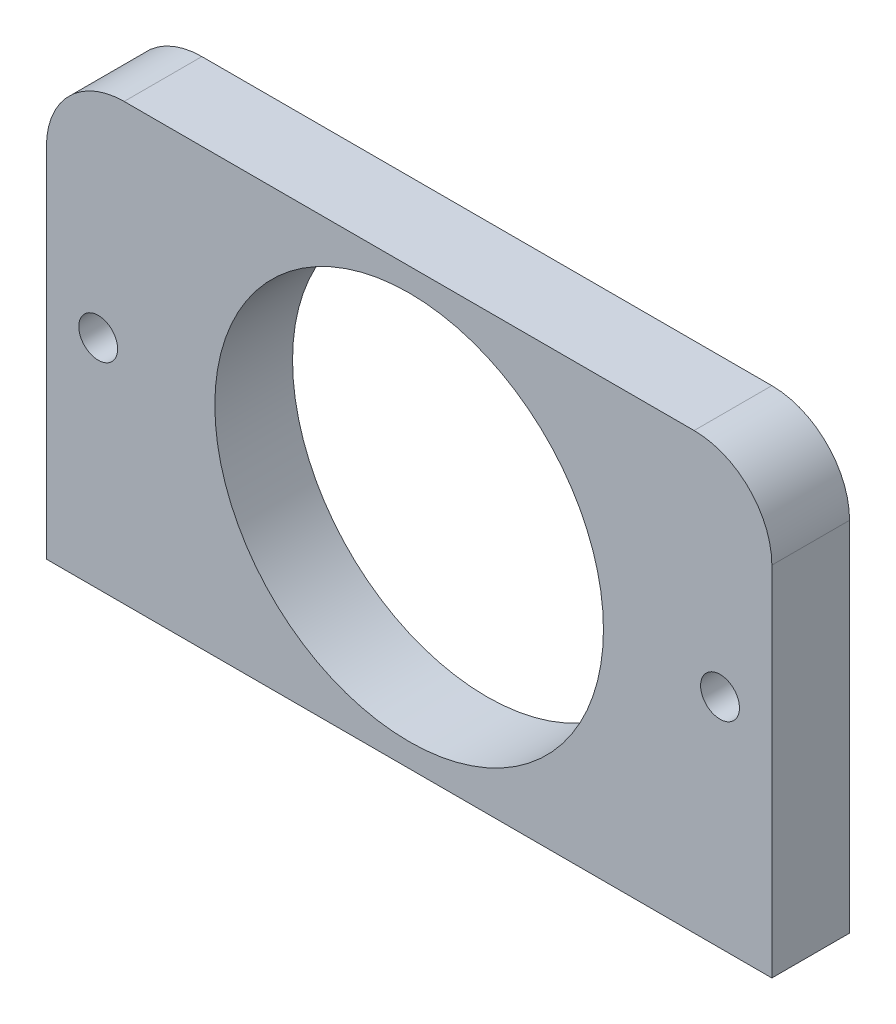
from build123d import *

# Parameters (mm, degrees)
SKETCH1_R           = 37.5
SKETCH1_R_2         = 3.75
BOSS_EXTRUDE1_DEPTH = 15


with BuildPart() as part:
    # Sketch1 → Boss-Extrude1 (new body)
    with BuildSketch(Plane.XY):
        with BuildLine():
            Line((-70, -42), (70, -42))
            Line((70, -42), (70, 27))
            ThreePointArc((70, 27), (65.606601718, 37.606601718), (55, 42))
            Line((55, 42), (-55, 42))
            ThreePointArc((-55, 42), (-65.606601718, 37.606601718), (-70, 27))
            Line((-70, 27), (-70, -42))
        make_face()
        Circle(SKETCH1_R, mode=Mode.SUBTRACT)
        with Locations((-60, 0)):
            Circle(SKETCH1_R_2, mode=Mode.SUBTRACT)
        with Locations(Location((60, 0, 0), (0, 0, 180))):
            Circle(SKETCH1_R_2, mode=Mode.SUBTRACT)
    extrude(amount=BOSS_EXTRUDE1_DEPTH)


solid = part.part
